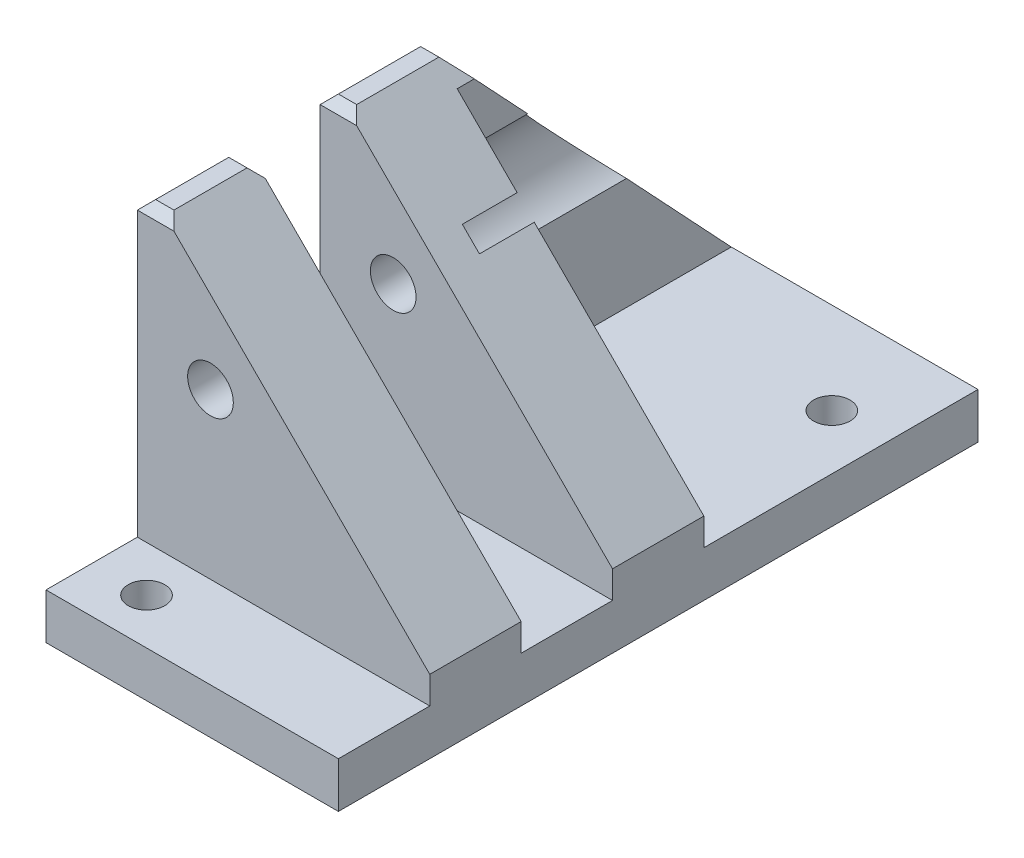
from build123d import *

# Parameters (mm, degrees)
EXTRUDE_1_DEPTH           = 70
CUT_EXTRUDE_1_DEPTH       = 100.498743711
SKETCH_3_W                = 10
SKETCH_3_H                = 45
CUT_EXTRUDE_2_DEPTH       = 92.782351245
CUT_EXTRUDE_5_DEPTH       = 92.782351245
CUT_EXTRUDE_6_DEPTH       = 87.740993769
SKETCH_8_W                = 30
SKETCH_8_H                = 32
CUT_EXTRUDE_7_DEPTH       = 27
CUT_EXTRUDE_8_DEPTH       = 84.654049513
SKETCH_10_R               = 2
CUT_EXTRUDE_9_DEPTH       = 27
SKETCH_15_R               = 2.5
CUT_EXTRUDE_11_DEPTH      = 86.399063227
CUT_EXTRUDE_12_DEPTH      = 26
CUT_EXTRUDE_12_DEPTH_BACK = 6
SKETCH_16_R               = 6.5
CHAMFER_1_SIZE            = 1


with BuildPart() as part:
    # 草图1 → 拉伸1 (new body)
    with BuildSketch(Plane.XY):
        Polygon((0, 0), (50, 0), (0, 50), align=None)
    extrude(amount=EXTRUDE_1_DEPTH)

    # 草图2 → 切除-拉伸1 (cut, through all)
    with BuildSketch(Plane.XY.offset(70)):
        Polygon((50, 0), (32, 0), (32, 18), align=None)
    extrude(amount=-CUT_EXTRUDE_1_DEPTH, mode=Mode.SUBTRACT)

    # 草图3 → 切除-拉伸2 (cut, through all)
    with BuildSketch(Plane(origin=(32, 0, 0), x_dir=(0, 0, -1), z_dir=(1, 0, 0))):
        with Locations((-65, 27.5)):
            Rectangle(SKETCH_3_W, SKETCH_3_H)
        with Locations((-45, 27.5)):
            Rectangle(SKETCH_3_W, SKETCH_3_H)
    extrude(amount=-CUT_EXTRUDE_2_DEPTH, mode=Mode.SUBTRACT)

    # 草图6 → 切除-拉伸5 (cut, through all)
    with BuildSketch(Plane.XY.offset(70)):
        Polygon((0, 50), (0, 40), (32, 8), (32, 18), align=None)
    extrude(amount=-CUT_EXTRUDE_5_DEPTH, mode=Mode.SUBTRACT)

    # 草图7 → 切除-拉伸6 (cut, through all)
    with BuildSketch(Plane.XY.offset(70)):
        Polygon((0, 40), (0, 37), (3, 37), align=None)
    extrude(amount=-CUT_EXTRUDE_6_DEPTH, mode=Mode.SUBTRACT)

    # 草图8 → 切除-拉伸7 (cut)
    with BuildSketch(Plane(origin=(32, 0, 0), x_dir=(0, 0, -1), z_dir=(1, 0, 0))):
        with Locations((-15, 21)):
            Rectangle(SKETCH_8_W, SKETCH_8_H)
    extrude(amount=-CUT_EXTRUDE_7_DEPTH, mode=Mode.SUBTRACT)

    # 草图9 → 切除-拉伸8 (cut, through all)
    with BuildSketch(Plane(origin=(5, 0, 0), x_dir=(0, 0, -1), z_dir=(1, 0, 0))):
        Polygon((0, 5), (0, 37), (-30, 37), align=None)
    extrude(amount=-CUT_EXTRUDE_8_DEPTH, mode=Mode.SUBTRACT)

    # 草图10 → 切除-拉伸9 (cut)
    with BuildSketch(Plane.XZ):
        with Locations(Location((6, 65, 0), (0, 0, 270))):
            Circle(SKETCH_10_R)
        with Locations(Location((26, 10, 0), (0, 0, 270))):
            Circle(SKETCH_10_R)
    extrude(amount=-CUT_EXTRUDE_9_DEPTH, mode=Mode.SUBTRACT)

    # 草图15 → 切除-拉伸11 (cut, through all)
    with BuildSketch(Plane.XY.offset(70)):
        with Locations((8, 23)):
            Circle(SKETCH_15_R)
    extrude(amount=-CUT_EXTRUDE_11_DEPTH, mode=Mode.SUBTRACT)

    # 草图16 → 切除-拉伸12 (cut, two sides: drawn at the far end of the back side and taken through both)
    with BuildSketch(Plane(origin=(0, 0, 30), x_dir=(-1, 0, 0), z_dir=(0, 0, -1)).offset(-CUT_EXTRUDE_12_DEPTH_BACK)):
        with Locations((-8, 23)):
            Circle(SKETCH_16_R)
    extrude(amount=CUT_EXTRUDE_12_DEPTH + CUT_EXTRUDE_12_DEPTH_BACK, mode=Mode.SUBTRACT)

    # 倒角1
    chamfer_1_edges = [part.edges().sort_by_distance(p)[0] for p in [
        (0, 37, 35),
        (1.5, 37, 60),
        (1.5, 37, 50),
        (1.5, 37, 40),
        (0, 37, 55),
    ]]
    chamfer(chamfer_1_edges, length=CHAMFER_1_SIZE)


solid = part.part
